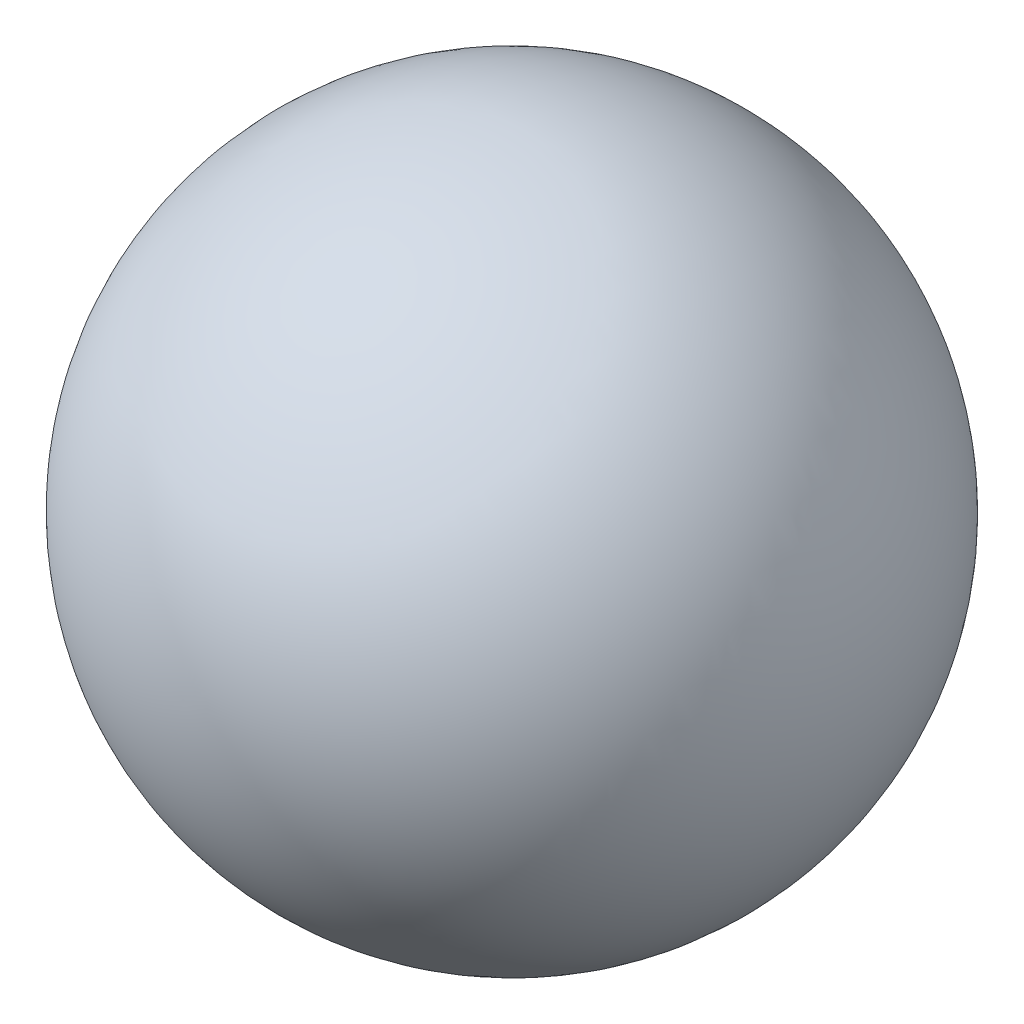
from build123d import *


with BuildPart() as part:
    # Sketch1 → Revolve1 (revolve)
    with BuildSketch(Plane(origin=(0, 0, 0), x_dir=(1, 0, 0), z_dir=(0, 1, 0))):
        with BuildLine():
            Line((0.498782215, 119.998963397), (0.498782215, -119.998963397))
            ThreePointArc((0.498782215, -119.998963397), (-120, 0), (0.498782215, 119.998963397))
        make_face()
    revolve(axis=Axis((0.498782215, 0, -119.998963397), (0, 0, 1)))


solid = part.part
